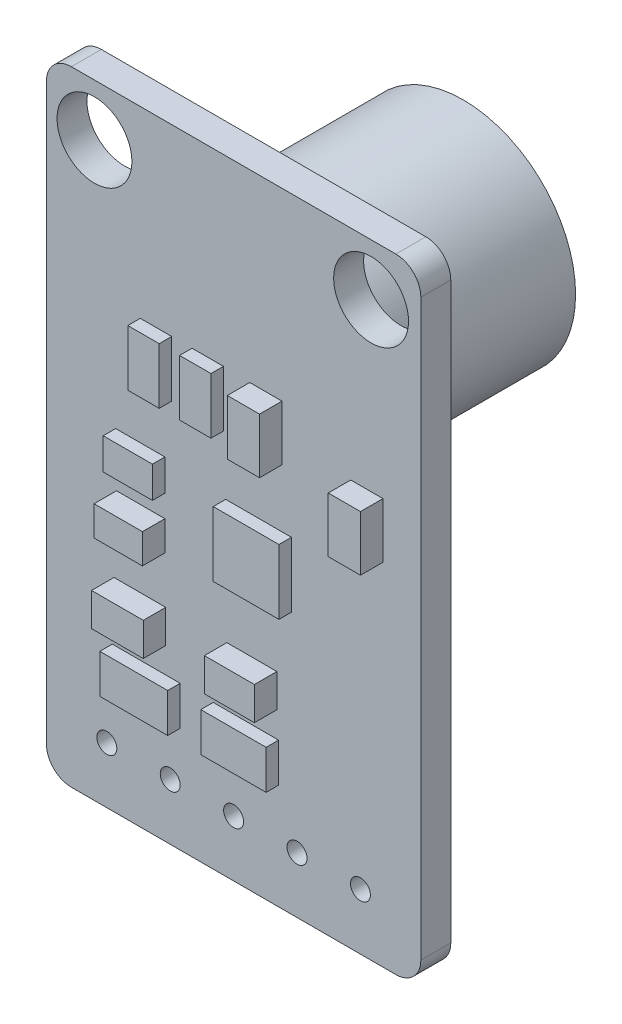
from build123d import *

# Parameters (mm, degrees)
BOSS_EXTRUDE1_DEPTH                  = 1.2
SKETCH2_R                            = 4.5
BOSS_EXTRUDE2_DEPTH                  = 8
F_3_0MM_DOWEL_HOLE1_D                = 3
F_3_0MM_DOWEL_HOLE1_DEPTH            = 2
F_3_0MM_DOWEL_HOLE1_TIP              = 0.901290929
F_97_0_03149606_DIAMETER_HOLE1_D     = 0.799999924
F_97_0_03149606_DIAMETER_HOLE1_DEPTH = 2
F_97_0_03149606_DIAMETER_HOLE1_TIP   = 0.240344225
SKETCH17_W                           = 2.632057762
SKETCH17_H                           = 2.598740575
BOSS_EXTRUDE5_DEPTH                  = 0.5
SKETCH18_W                           = 2.719328156
SKETCH18_H                           = 1.56361369
SKETCH18_W_2                         = 2.61735335
BOSS_EXTRUDE6_DEPTH                  = 0.5
SKETCH19_W                           = 2.073487719
SKETCH19_H                           = 1.325672476
SKETCH19_W_2                         = 2.005504515
BOSS_EXTRUDE7_DEPTH                  = 0.9
SKETCH20_W                           = 1.971512913
SKETCH20_H                           = 1.257689272
SKETCH20_W_2                         = 1.257689272
SKETCH20_H_2                         = 2.243445728
SKETCH20_W_3                         = 1.257689273
BOSS_EXTRUDE8_DEPTH                  = 0.5
SKETCH21_W                           = 1.937521311
SKETCH21_H                           = 1.189706068
SKETCH21_W_2                         = 1.291680874
SKETCH21_H_2                         = 2.209454126
BOSS_EXTRUDE9_DEPTH                  = 0.9


with BuildPart() as part:
    # Sketch1 → Boss-Extrude1 (new body)
    with BuildSketch(Plane.XY):
        with BuildLine():
            Line((1, 0), (14, 0))
            ThreePointArc((14, 0), (14.707106781, -0.292893219), (15, -1))
            Line((15, -1), (15, -24))
            ThreePointArc((15, -24), (14.707106781, -24.707106781), (14, -25))
            Line((14, -25), (1, -25))
            ThreePointArc((1, -25), (0.292893219, -24.707106781), (0, -24))
            Line((0, -24), (0, -1))
            ThreePointArc((0, -1), (0.292893219, -0.292893219), (1, 0))
        make_face()
    extrude(amount=BOSS_EXTRUDE1_DEPTH)

    # Sketch2 → Boss-Extrude2 (add)
    with BuildSketch(Plane.XY):
        with Locations((7.5, -7)):
            Circle(SKETCH2_R)
    extrude(amount=-BOSS_EXTRUDE2_DEPTH)

    # Ø3.0mm Dowel Hole1
    with Locations(Plane(origin=(0, 0, 0), x_dir=(-1, 0, 0), z_dir=(0, 0, -1))):
        with Locations((-13.006639516, -2.081574002), (-1.92537728, -2.081574002)):
            Hole(F_3_0MM_DOWEL_HOLE1_D / 2, depth=F_3_0MM_DOWEL_HOLE1_DEPTH)
            with Locations((0, 0, -(F_3_0MM_DOWEL_HOLE1_DEPTH + F_3_0MM_DOWEL_HOLE1_TIP / 2))):  # 118° drill point
                Cone(0, F_3_0MM_DOWEL_HOLE1_D / 2, F_3_0MM_DOWEL_HOLE1_TIP, mode=Mode.SUBTRACT)

    # #97 (0.03149606) Diameter Hole1
    with Locations(Plane(origin=(0, 0, 0), x_dir=(-1, 0, 0), z_dir=(0, 0, -1))):
        with Locations((-7.5, -22.748467988), (-10.04, -22.748467988), (-12.58, -22.748467988), (-4.96, -22.748467988), (-2.42, -22.748467988)):
            Hole(F_97_0_03149606_DIAMETER_HOLE1_D / 2, depth=F_97_0_03149606_DIAMETER_HOLE1_DEPTH)
            with Locations((0, 0, -(F_97_0_03149606_DIAMETER_HOLE1_DEPTH + F_97_0_03149606_DIAMETER_HOLE1_TIP / 2))):  # 118° drill point
                Cone(0, F_97_0_03149606_DIAMETER_HOLE1_D / 2, F_97_0_03149606_DIAMETER_HOLE1_TIP, mode=Mode.SUBTRACT)

    # Sketch17 → Boss-Extrude5 (add)
    with BuildSketch(Plane.XY.offset(1.2)):
        with Locations((8.499275401, -13.218640589)):
            Rectangle(SKETCH17_W, SKETCH17_H)
    extrude(amount=BOSS_EXTRUDE5_DEPTH)

    # Sketch18 → Boss-Extrude6 (add)
    with BuildSketch(Plane.XY.offset(1.2)):
        with Locations((3.998864999, -19.99514823)):
            Rectangle(SKETCH18_W, SKETCH18_H)
        with Locations((7.992878228, -19.99514823)):
            Rectangle(SKETCH18_W_2, SKETCH18_H)
    extrude(amount=BOSS_EXTRUDE6_DEPTH)

    # Sketch19 → Boss-Extrude7 (add)
    with BuildSketch(Plane.XY.offset(1.2)):
        with Locations((3.743927985, -17.530757089)):
            Rectangle(SKETCH19_W, SKETCH19_H)
        with Locations((8.230819441, -17.530757089)):
            Rectangle(SKETCH19_W_2, SKETCH19_H)
    extrude(amount=BOSS_EXTRUDE7_DEPTH)

    # Sketch20 → Boss-Extrude8 (add)
    with BuildSketch(Plane.XY.offset(1.2)):
        with Locations((3.760923786, -12.296050388)):
            Rectangle(SKETCH20_W, SKETCH20_H)
        with Locations((4.389768422, -8.471995169)):
            Rectangle(SKETCH20_W_2, SKETCH20_H_2)
        with Locations((6.463256141, -8.471995169)):
            Rectangle(SKETCH20_W_3, SKETCH20_H_2)
    extrude(amount=BOSS_EXTRUDE8_DEPTH)

    # Sketch21 → Boss-Extrude9 (add)
    with BuildSketch(Plane.XY.offset(1.2)):
        with Locations((3.777919587, -14.403529709)):
            Rectangle(SKETCH21_W, SKETCH21_H)
        with Locations((8.791680874, -8.48899097)):
            Rectangle(SKETCH21_W_2, SKETCH21_H_2)
        with Locations((12.836681506, -9.848655048)):
            Rectangle(SKETCH21_W_2, SKETCH21_H_2)
    extrude(amount=BOSS_EXTRUDE9_DEPTH)


solid = part.part
